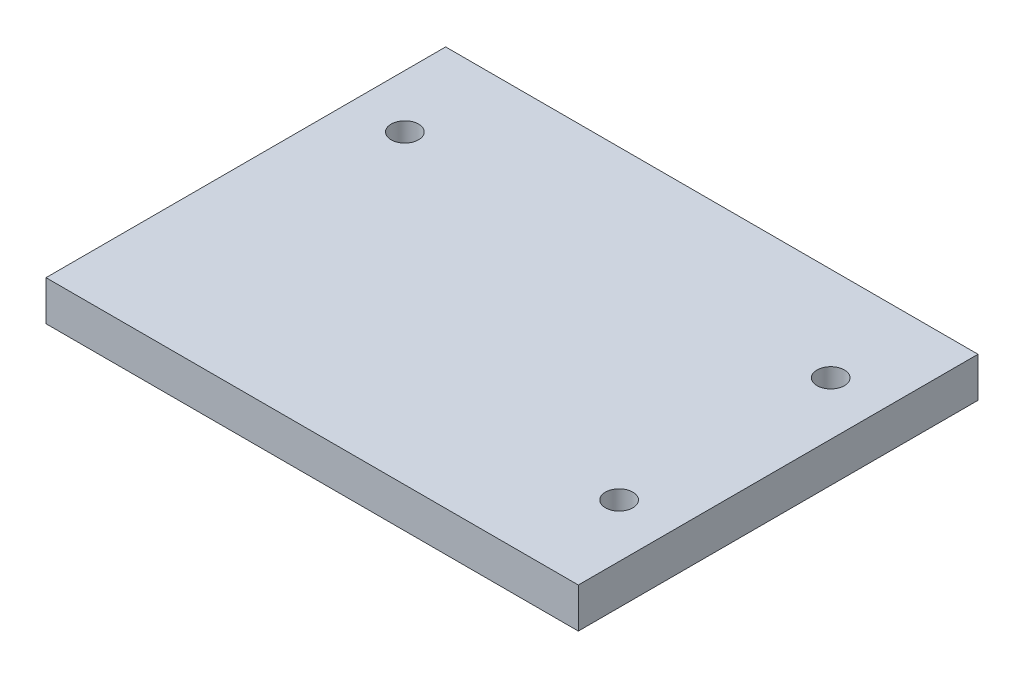
from build123d import *

# Parameters (mm, degrees)
SKETCH1_W           = 127
SKETCH1_H           = 95.34985535
SKETCH1_R           = 3.2639
BOSS_EXTRUDE1_DEPTH = 9.525


with BuildPart() as part:
    # Sketch1 → Boss-Extrude1 (new body)
    with BuildSketch(Plane(origin=(0, 0, 0), x_dir=(1, 0, 0), z_dir=(0, 1, 0))):
        with Locations((1.506e-06, 55.24971147)):
            Rectangle(SKETCH1_W, SKETCH1_H)
        with Locations((-50.8000007, 80.487207029)):
            Circle(SKETCH1_R, mode=Mode.SUBTRACT)
        with Locations((50.800003712, 80.487207029)):
            Circle(SKETCH1_R, mode=Mode.SUBTRACT)
        with Locations((50.800003712, 30.012215911)):
            Circle(SKETCH1_R, mode=Mode.SUBTRACT)
    extrude(amount=BOSS_EXTRUDE1_DEPTH)


solid = part.part
